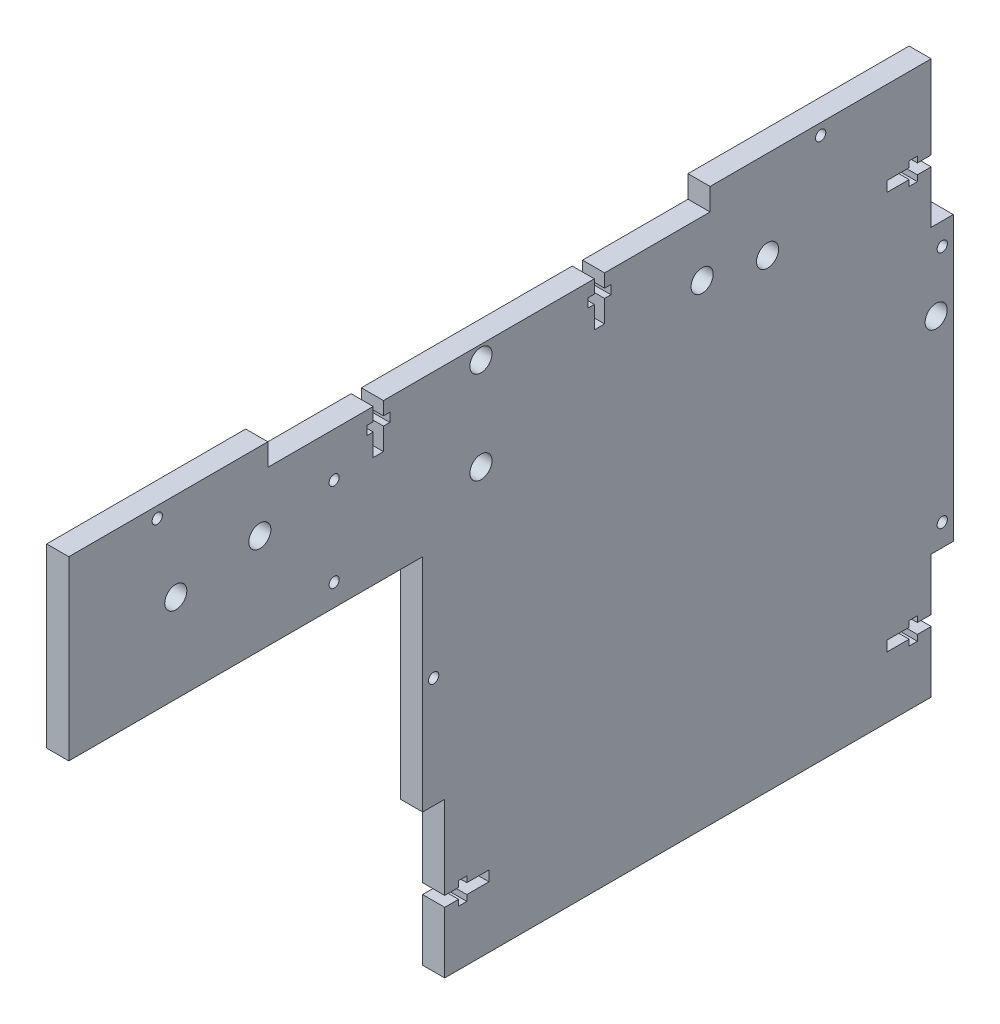
from build123d import *

# Parameters (mm, degrees)
BOSS_EXTRUDE1_DEPTH = 6.35
CUT_EXTRUDE1_DEPTH  = 212.560806862
SKETCH4_W           = 6.35
SKETCH4_H           = 63.5
SKETCH4_H_2         = 81.28
BOSS_EXTRUDE3_DEPTH = 6.35
SKETCH5_R           = 1.4732
CUT_EXTRUDE2_DEPTH  = 216.806597443
SKETCH6_R           = 3.175
SKETCH6_R_2         = 1.4732
CUT_EXTRUDE3_DEPTH  = 216.806597443
CUT_EXTRUDE4_REACH  = 217.807
SKETCH7_R           = 3.175
SKETCH8_R           = 1.4605
CUT_EXTRUDE5_DEPTH  = 216.806597443


with BuildPart() as part:
    # Sketch1 → Boss-Extrude1 (new body)
    with BuildSketch(Plane(origin=(0, 0, 0), x_dir=(0, 0, -1), z_dir=(1, 0, 0))):
        Polygon((0, 0), (139.7, 0), (139.7, 158.75), (76.2, 158.75), (76.2, 152.4), (0, 152.4), (-50.8, 152.4), (-50.8, 158.75), (-107.95, 158.75), (-107.95, 107.95), (0, 107.95), align=None)
    extrude(amount=BOSS_EXTRUDE1_DEPTH)

    # Sketch2 → Cut-Extrude1 (cut, through all)
    with BuildSketch(Plane.ZY):
        Polygon((0, 17.5768), (-3.96875, 17.5768), (-3.96875, 15.875), (-6.35, 15.875), (-6.35, 17.5768), (-12.7, 17.5768), (-12.7, 20.5232), (-6.35, 20.5232), (-6.35, 22.225), (-3.96875, 22.225), (-3.96875, 20.5232), (0, 20.5232), align=None)
        Polygon((-139.7, 17.5768), (-139.7, 20.5232), (-135.73125, 20.5232), (-135.73125, 22.225), (-133.35, 22.225), (-133.35, 20.5232), (-127, 20.5232), (-127, 17.5768), (-133.35, 17.5768), (-133.35, 15.875), (-135.73125, 15.875), (-135.73125, 17.5768), align=None)
        Polygon((-133.35, 136.525), (-133.35, 134.8232), (-127, 134.8232), (-127, 131.8768), (-133.35, 131.8768), (-133.35, 130.175), (-135.73125, 130.175), (-135.73125, 131.8768), (-139.7, 131.8768), (-139.7, 134.8232), (-135.73125, 134.8232), (-135.73125, 136.525), align=None)
    extrude(amount=-CUT_EXTRUDE1_DEPTH, mode=Mode.SUBTRACT)

    # Sketch4 → Boss-Extrude3 (add)
    with BuildSketch(Plane.ZY):
        with Locations((3.175, 76.2)):
            Rectangle(SKETCH4_W, SKETCH4_H)
        with Locations((-142.875, 76.2)):
            Rectangle(SKETCH4_W, SKETCH4_H_2)
    extrude(amount=-BOSS_EXTRUDE3_DEPTH)

    # Sketch5 → Cut-Extrude2 (cut, through all)
    with BuildSketch(Plane.ZY):
        with Locations(Location((3.175, 76.2, 0), (0, 0, 180))):
            Circle(SKETCH5_R)
        with Locations((-142.875, 41.91)):
            Circle(SKETCH5_R)
        with Locations(Location((-142.875, 110.49, 0), (0, 0, 180))):
            Circle(SKETCH5_R)
    extrude(amount=-CUT_EXTRUDE2_DEPTH, mode=Mode.SUBTRACT)

    # Sketch6 → Cut-Extrude3 (cut, through all)
    with BuildSketch(Plane.ZY):
        with Locations((-92.71, 133.35)):
            Circle(SKETCH6_R)
        with Locations((-107.95, 155.575)):
            Circle(SKETCH6_R_2)
        with Locations((-73.914, 136.503809764)):
            Circle(SKETCH6_R)
        with Locations((82.55, 155.575)):
            Circle(SKETCH6_R_2)
        with Locations((77.227381395, 133.35)):
            Circle(SKETCH6_R)
        with Locations((53.096, 136.503809756)):
            Circle(SKETCH6_R)
        with Locations((-10.409000001, 121.89880976)):
            Circle(SKETCH6_R)
        with Locations((-10.408999999, 148.476804796)):
            Circle(SKETCH6_R)
        Polygon((-42.9641, 152.4), (-45.9105, 152.4), (-45.9105, 148.59), (-47.7393, 148.59), (-47.7393, 146.05), (-45.9105, 146.05), (-45.9105, 139.7), (-42.9641, 139.7), (-42.9641, 146.05), (-41.1353, 146.05), (-41.1353, 148.59), (-42.9641, 148.59), align=None)
        Polygon((20.5359, 152.4), (17.5895, 152.4), (17.5895, 148.59), (15.7607, 148.59), (15.7607, 146.05), (17.5895, 146.05), (17.5895, 139.7), (20.5359, 139.7), (20.5359, 146.05), (22.3647, 146.05), (22.3647, 148.59), (20.5359, 148.59), align=None)
    extrude(amount=-CUT_EXTRUDE3_DEPTH, mode=Mode.SUBTRACT)

    # Sketch7 → Cut-Extrude4 (cut, up to next)
    with BuildSketch(Plane(origin=(6.35, 0, 0), x_dir=(0, 0, -1), z_dir=(1, 0, 0)), mode=Mode.PRIVATE) as cut_extrude4_sk1:
        with Locations((141.119403898, 94.059701015)):
            Circle(SKETCH7_R)
    cut_extrude4_tool1 = extrude(cut_extrude4_sk1.sketch, amount=-CUT_EXTRUDE4_REACH, mode=Mode.PRIVATE) & part.part
    add(cut_extrude4_tool1.solids().sort_by_distance((6.35, 94.059701, -141.119404))[0], mode=Mode.SUBTRACT)

    # Sketch8 → Cut-Extrude5 (cut, through all)
    with BuildSketch(Plane.ZY):
        with Locations((31.75, 114.3)):
            Circle(SKETCH8_R)
        with Locations((31.75, 139.7)):
            Circle(SKETCH8_R)
    extrude(amount=-CUT_EXTRUDE5_DEPTH, mode=Mode.SUBTRACT)


solid = part.part
